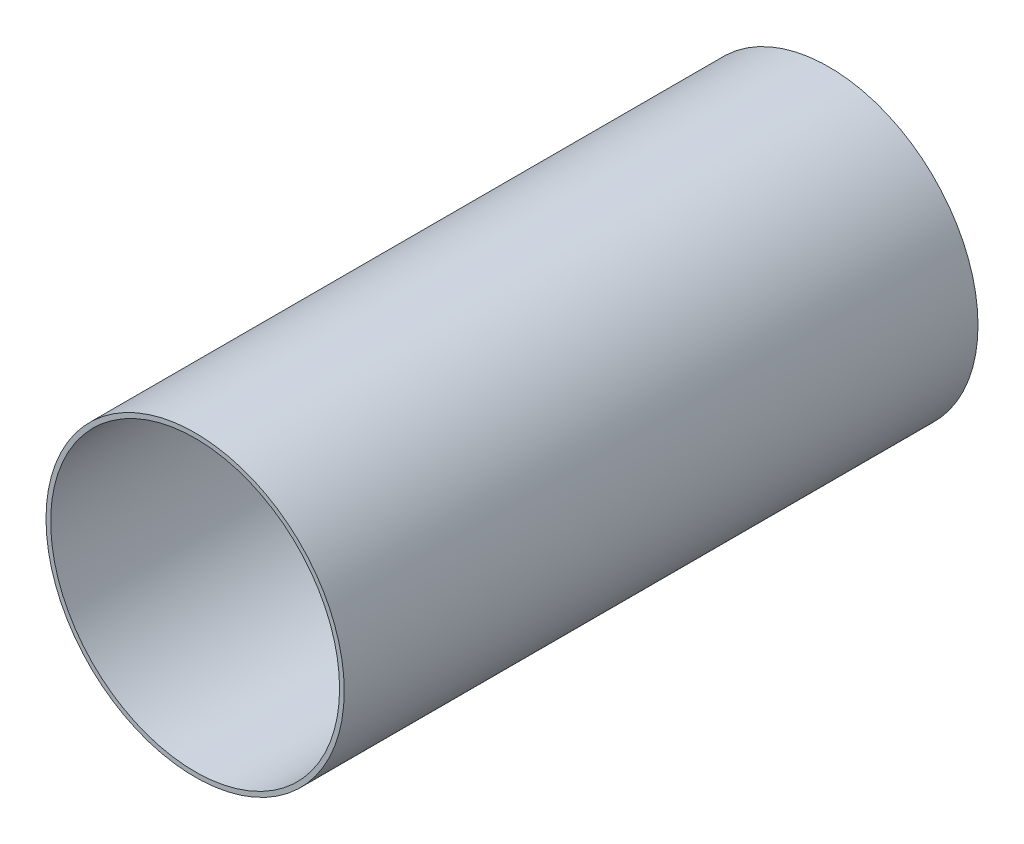
from build123d import *

# Parameters (mm, degrees)
SKETCH1_R           = 101.6
SKETCH1_R_2         = 98.425
BOSS_EXTRUDE1_DEPTH = 431.8


with BuildPart() as part:
    # Sketch1 → Boss-Extrude1 (new body)
    with BuildSketch(Plane.XY):
        Circle(SKETCH1_R)
        Circle(SKETCH1_R_2, mode=Mode.SUBTRACT)
    extrude(amount=BOSS_EXTRUDE1_DEPTH)


solid = part.part
